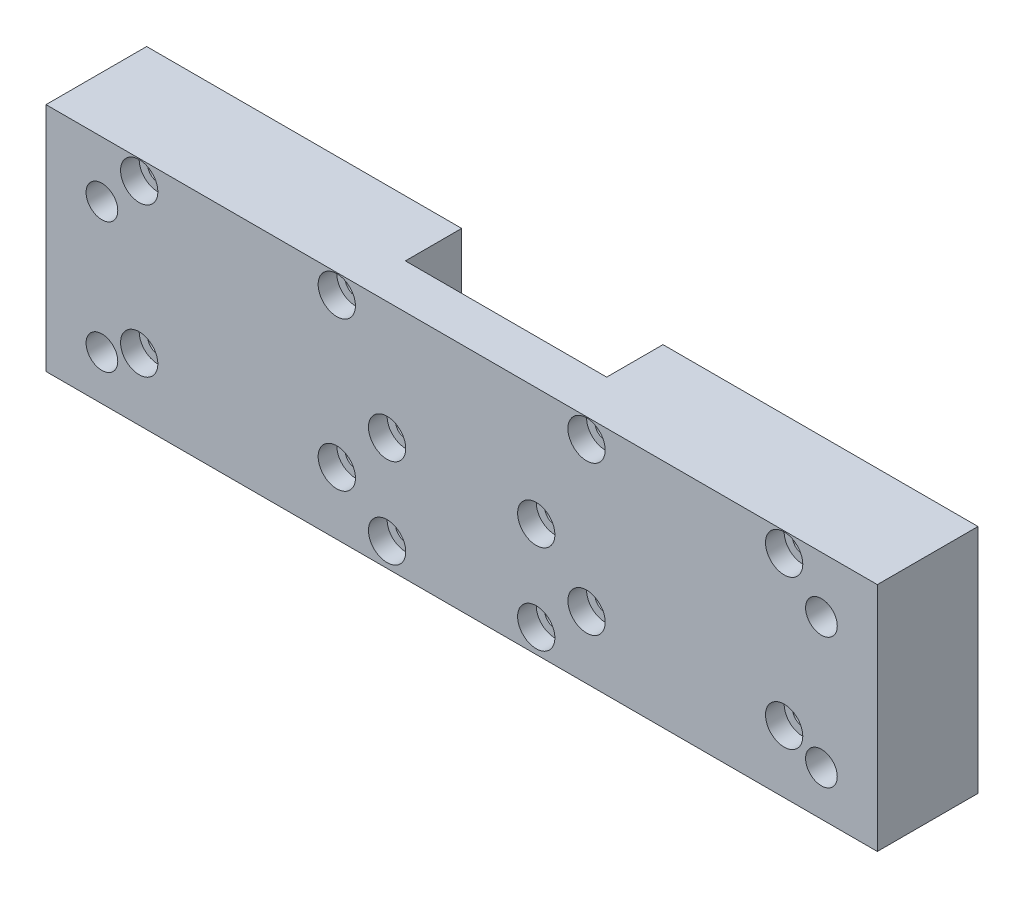
from build123d import *

# Parameters (mm, degrees)
BOSS_EXTRUDE1_DEPTH            = 31
M10X1_5_TAPPED_HOLE1_D         = 8.5
CBORE_FOR_M5_SHCS1_D           = 5.5
CBORE_FOR_M5_SHCS1_CBORE_D     = 10
CBORE_FOR_M5_SHCS1_CBORE_DEPTH = 5
CBORE_FOR_M5_SHCS2_D           = 5.5
CBORE_FOR_M5_SHCS2_CBORE_D     = 10
CBORE_FOR_M5_SHCS2_CBORE_DEPTH = 5


with BuildPart() as part:
    # Sketch1 → Boss-Extrude1 (new, symmetric)
    with BuildSketch(Plane(origin=(0, 0, 0), x_dir=(1, 0, 0), z_dir=(0, 1, 0))):
        Polygon((-27, 0), (27, 0), (27, 15.1), (111.5, 15.1), (111.5, -11.9), (-111.5, -11.9), (-111.5, 15.1), (-27, 15.1), align=None)
    extrude(amount=BOSS_EXTRUDE1_DEPTH, both=True)

    # M10x1.5 Tapped Hole1 (through all)
    with Locations(Plane.XY.offset(11.9)):
        with Locations((-96.5, 16), (-96.5, -19), (96.5, 16), (96.5, -19)):
            Hole(M10X1_5_TAPPED_HOLE1_D / 2)

    # CBORE for M5 SHCS1 (through all)
    with Locations(Plane.XY.offset(11.9)):
        with Locations((-86.5, 25.75), (-86.5, -14.25), (-33.5, 25.75), (-33.5, -14.25), (33.5, 25.75), (86.5, 25.75), (33.5, -14.25), (86.5, -14.25)):
            CounterBoreHole(CBORE_FOR_M5_SHCS1_D / 2, CBORE_FOR_M5_SHCS1_CBORE_D / 2, CBORE_FOR_M5_SHCS1_CBORE_DEPTH)

    # CBORE for M5 SHCS2 (through all)
    with Locations(Plane.XY.offset(11.9)):
        with Locations((-20, -0.65), (20, -0.65), (20, -24.65), (-20, -24.65)):
            CounterBoreHole(CBORE_FOR_M5_SHCS2_D / 2, CBORE_FOR_M5_SHCS2_CBORE_D / 2, CBORE_FOR_M5_SHCS2_CBORE_DEPTH)


solid = part.part
